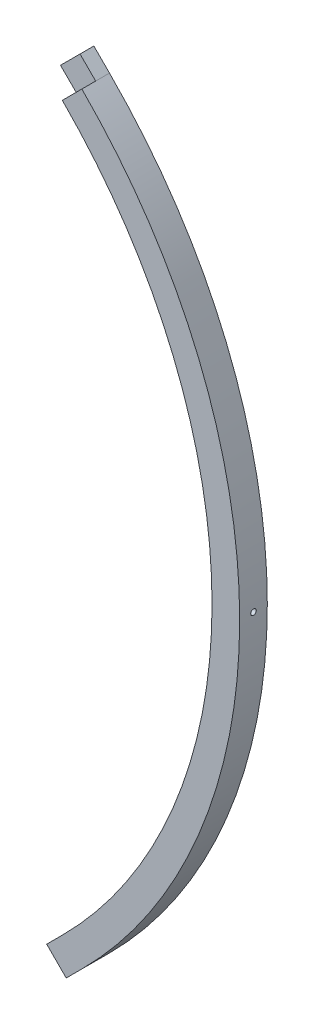
from build123d import *

# Parameters (mm, degrees)
IZIM1_R                     = 195
IZIM1_R_2                   = 185
Y_KSEKLIK_EKSTR_ZYON1_DEPTH = 10
KES_EKSTR_ZYON1_DEPTH       = 250
KES_EKSTR_ZYON1_DEPTH_BACK  = 240
IZIM2_R                     = 1
KES_EKSTR_ZYON2_DEPTH       = 240
KES_EKSTR_ZYON2_DEPTH_BACK  = 240
IZIM3_R                     = 1
KES_EKSTR_ZYON3_DEPTH       = 139
IZIM6_W                     = 5
IZIM6_H                     = 10
Y_KSEKLIK_EKSTR_ZYON2_DEPTH = 8
IZIM7_W                     = 5
IZIM7_H                     = 10
Y_KSEKLIK_EKSTR_ZYON3_DEPTH = 8


with BuildPart() as part:
    # Çizim1 → Yükseklik-Ekstrüzyon1 (new body)
    with BuildSketch(Plane.XY):
        Circle(IZIM1_R)
        Circle(IZIM1_R_2, mode=Mode.SUBTRACT)
    extrude(amount=Y_KSEKLIK_EKSTR_ZYON1_DEPTH)

    # Çizim2 → Kes-Ekstrüzyon1 (cut, two sides: drawn at the far end of the back side and taken through both)
    with BuildSketch(Plane(origin=(0, 0, 0), x_dir=(0, 0, -1), z_dir=(1, 0, 0)).offset(-KES_EKSTR_ZYON1_DEPTH_BACK)):
        with Locations((-5, 0)):
            Circle(IZIM2_R)
    extrude(amount=KES_EKSTR_ZYON1_DEPTH + KES_EKSTR_ZYON1_DEPTH_BACK, mode=Mode.SUBTRACT)

    # Çizim3 → Kes-Ekstrüzyon2 (cut, two sides: drawn at the far end of the back side and taken through both)
    with BuildSketch(Plane(origin=(0, 0, 0), x_dir=(1, 0, 0), z_dir=(0, 1, 0)).offset(-KES_EKSTR_ZYON2_DEPTH_BACK)):
        with Locations((0, -5)):
            Circle(IZIM3_R)
    extrude(amount=KES_EKSTR_ZYON2_DEPTH + KES_EKSTR_ZYON2_DEPTH_BACK, mode=Mode.SUBTRACT)

    # Çizim4 → Kes-Ekstrüzyon3 (cut)
    with BuildSketch(Plane(origin=(0, 0, 0), x_dir=(-1, 0, 0), z_dir=(0, 0, -1))):
        with BuildLine():
            ThreePointArc((-137.885822331, -137.885822331), (195, 0), (-137.885822331, 137.885822331))
            Line((-137.885822331, 137.885822331), (-130.81475452, 130.81475452))
            ThreePointArc((-130.81475452, 130.81475452), (-185, 0), (-130.81475452, -130.81475452))
            Line((-130.81475452, -130.81475452), (-137.885822331, -137.885822331))
        make_face()
    extrude(amount=-KES_EKSTR_ZYON3_DEPTH, mode=Mode.SUBTRACT)

    # Çizim6 → Yükseklik-Ekstrüzyon2 (add)
    with BuildSketch(Plane(origin=(0, 0, 0), x_dir=(0, 0, 1), z_dir=(-0.7071067811865477, -0.7071067811865475, 0))):
        with Locations((7.5, -190)):
            Rectangle(IZIM6_W, IZIM6_H)
    extrude(amount=Y_KSEKLIK_EKSTR_ZYON2_DEPTH)

    # Çizim7 → Yükseklik-Ekstrüzyon3 (add)
    with BuildSketch(Plane(origin=(0, 0, 0), x_dir=(0, 0, 1), z_dir=(-0.7071067811865477, 0.7071067811865475, 0))):
        with Locations((2.5, 190)):
            Rectangle(IZIM7_W, IZIM7_H)
    extrude(amount=Y_KSEKLIK_EKSTR_ZYON3_DEPTH)


solid = part.part
